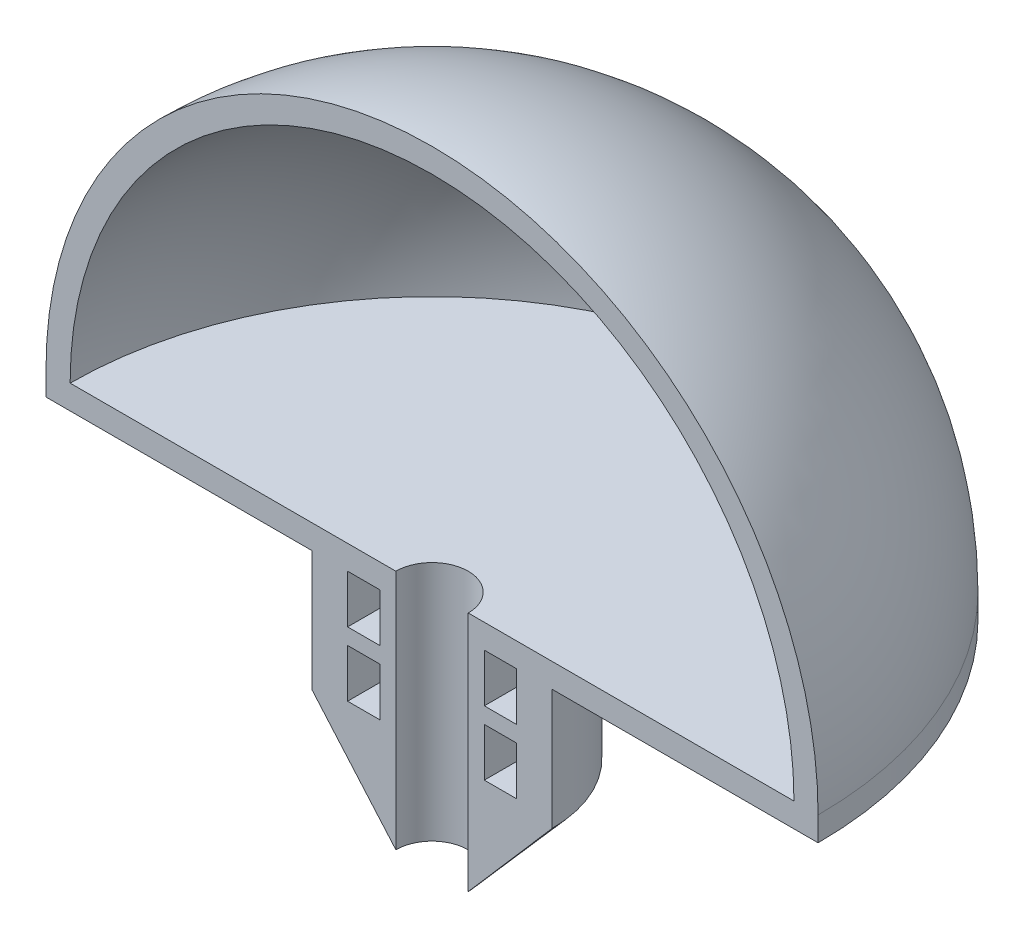
from build123d import *

# Parameters (mm, degrees)
REVOLUCI_N1_ANGLE     = 180
CROQUIS2_W            = 2
CROQUIS2_H            = 3
CORTAR_EXTRUIR1_DEPTH = 15
CROQUIS3_W            = 7.076217781
CROQUIS3_H            = 3
CROQUIS3_W_2          = 6.688868885
CORTAR_EXTRUIR2_DEPTH = 6.500003


with BuildPart() as part:
    # Croquis1 → Revolución1 (revolve)
    with BuildSketch(Plane.XY):
        with BuildLine():
            Line((-51.782166939, -4.382597623), (-31.532166939, -4.382597623))
            Line((-31.532166939, -4.382597623), (-31.532166939, -14.382597623))
            Line((-31.532166939, -14.382597623), (-31.532166939, -19.382597623))
            Line((-31.532166939, -19.382597623), (-36.748543174, -13.37211471))
            Line((-36.748543174, -13.37211471), (-36.748543174, -5.882597623))
            Line((-36.748543174, -5.882597623), (-43.248543174, -5.882597623))
            Line((-43.248543174, -5.882597623), (-53.282166939, -5.882597623))
            Line((-53.282166939, -5.882597623), (-53.282166939, -4.382597623))
            ThreePointArc((-53.282166939, -4.382597623), (-46.252729688, 12.587965125), (-29.282166939, 19.617402377))
            Line((-29.282166939, 19.617402377), (-29.282166939, 18.117402377))
            ThreePointArc((-29.282166939, 18.117402377), (-45.192069516, 11.527304954), (-51.782166939, -4.382597623))
        make_face()
    revolve(axis=Axis((-29.282166939, 19.617402377, 0), (0, -1, 0)), revolution_arc=REVOLUCI_N1_ANGLE)

    # Croquis2 → Cortar-Extruir1 (cut)
    with BuildSketch(Plane.XY):
        with Locations((-33.532166939, -7.382597623)):
            Rectangle(CROQUIS2_W, CROQUIS2_H)
        with Locations((-25.032166939, -7.382597623)):
            Rectangle(CROQUIS2_W, CROQUIS2_H)
        with Locations((-25.032166939, -11.382597623)):
            Rectangle(CROQUIS2_W, CROQUIS2_H)
        with Locations((-33.532166939, -11.382597623)):
            Rectangle(CROQUIS2_W, CROQUIS2_H)
    extrude(amount=-CORTAR_EXTRUIR1_DEPTH, mode=Mode.SUBTRACT)

    # Croquis3 → Cortar-Extruir2 (cut)
    with BuildSketch(Plane(origin=(-26.032166939, 0, 0), x_dir=(0, 0, -1), z_dir=(1, 0, 0))):
        with Locations((8.321249271, -11.382597623)):
            Rectangle(CROQUIS3_W, CROQUIS3_H)
        with Locations((8.127574822, -7.382597623)):
            Rectangle(CROQUIS3_W_2, CROQUIS3_H)
    extrude(amount=-CORTAR_EXTRUIR2_DEPTH, mode=Mode.SUBTRACT)


solid = part.part
